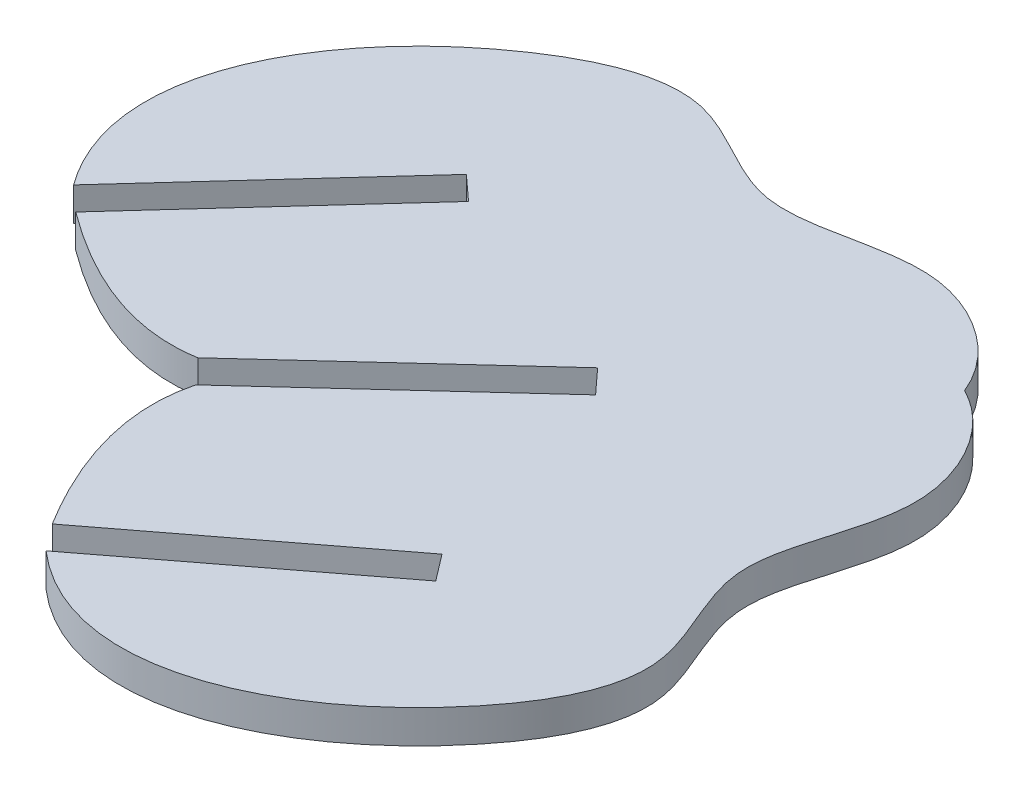
from build123d import *

# Parameters (mm, degrees)
EXTRUDE_1_DEPTH = 4


with BuildPart() as part:
    # Эскиз1 → Бобышка-Вытянуть1 (new body)
    with BuildSketch(Plane(origin=(0, 0, 0), x_dir=(1, 0, 0), z_dir=(0, 1, 0))):
        with BuildLine():
            Line((6.059908157, 118.392686307), (28.593973382, 143.125900973))
            Line((28.593973382, 143.125900973), (31.550796909, 140.431982892))
            Line((31.550796909, 140.431982892), (9.016731683, 115.698768225))
            add(Edge.make_bspline(
                [(9.016731683, 115.698768225), (21.831674205, 106.194204472), (31.550796909, 107.859296928)],
                knots=[0, 0, 0, 1, 1, 1], degree=2))
            Line((31.550796909, 107.859296928), (56.649035515, 130.866687174))
            Line((56.649035515, 130.866687174), (59.351976898, 127.918109911))
            Line((59.351976898, 127.918109911), (34.253738292, 104.910719665))
            add(Edge.make_bspline(
                [(40.108512431, 81.781451939), (31.751660046, 95.372717596), (34.253738292, 104.910719665)],
                knots=[0, 0, 0, 1, 1, 1], degree=2))
            Line((40.108512431, 81.781451939), (66.703590649, 102.084599918))
            Line((66.703590649, 102.084599918), (69.130805487, 98.905193034))
            Line((69.130805487, 98.905193034), (42.535727268, 78.602045055))
            add(Edge.make_bspline(
                [(42.535727268, 78.602045055), (55.815710688, 67.080310927), (80.094766474, 77.881516918), (94.120739474, 103.222216708), (82.757628545, 119.035683166), (93.554720003, 135.259749049), (86.176436575, 148.029815365), (81.0994368, 150.567036284)],
                knots=[0, 0, 0, 0, 0.411773236, 0.560770406, 0.685497453, 0.854203012, 1, 1, 1, 1], degree=3))
            add(Edge.make_bspline(
                [(6.059908157, 118.392686307), (-4.266159161, 132.622255896), (8.600850307, 155.872603594), (35.062931054, 167.647036362), (49.830860852, 154.954744966), (66.930538064, 164.303463432), (79.012282091, 155.845028509), (81.0994368, 150.567036284)],
                knots=[0, 0, 0, 0, 0.411773236, 0.560770406, 0.685497453, 0.854203012, 1, 1, 1, 1], degree=3))
        make_face()
    extrude(amount=EXTRUDE_1_DEPTH)


solid = part.part
